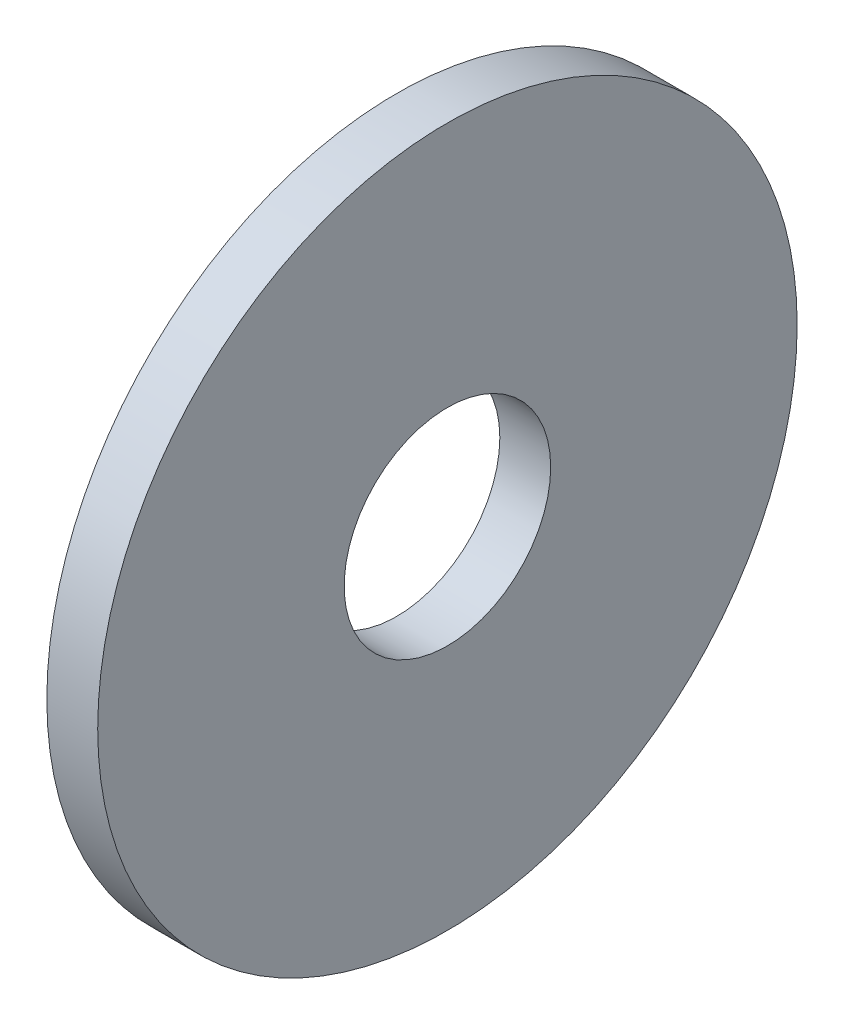
from build123d import *

# Parameters (mm, degrees)
SKETCH1_R           = 8.73125
SKETCH1_R_2         = 2.5781
BOSS_EXTRUDE1_DEPTH = 1.27


with BuildPart() as part:
    # Sketch1 → Boss-Extrude1 (new body)
    with BuildSketch(Plane(origin=(0, 0, 0), x_dir=(0, 0, -1), z_dir=(1, 0, 0))):
        Circle(SKETCH1_R)
        Circle(SKETCH1_R_2, mode=Mode.SUBTRACT)
    extrude(amount=BOSS_EXTRUDE1_DEPTH)


solid = part.part
